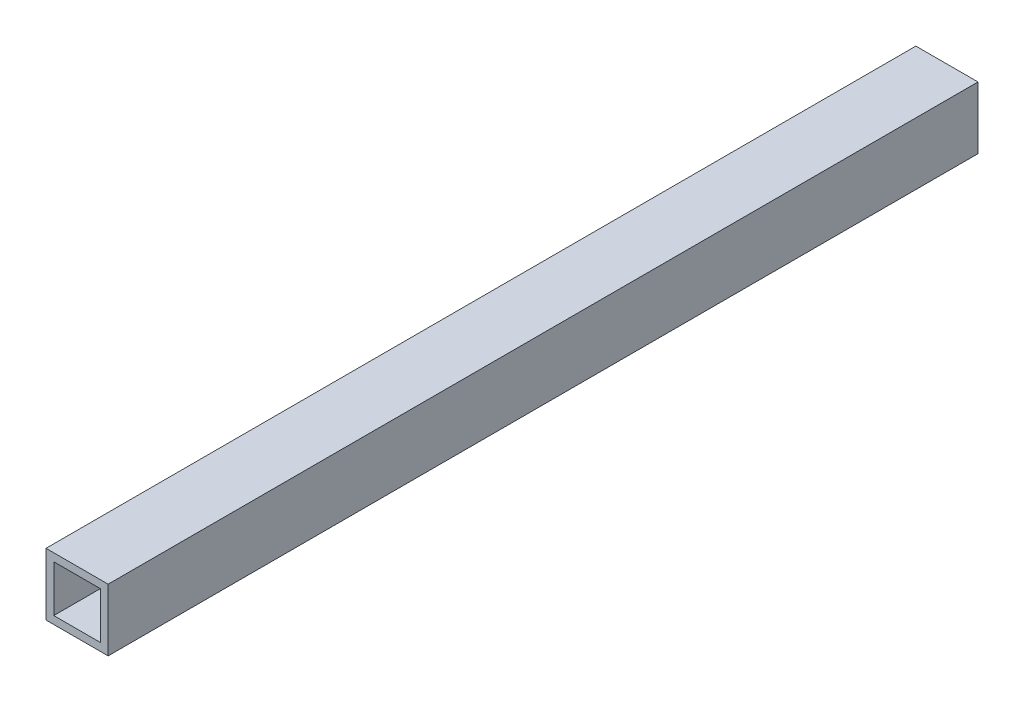
from build123d import *

# Parameters (mm, degrees)
BOSS_EXTRUDE1_DEPTH      = 177.8
BOSS_EXTRUDE1_DEPTH_BACK = 177.8
SKETCH3_W                = 25.4
SKETCH3_H                = 25.4
SKETCH3_W_2              = 19.05
SKETCH3_H_2              = 19.05


with BuildPart() as part:
    # Sketch3 → Boss-Extrude1 (new, two sides: drawn at the far end of the back side and taken through both)
    with BuildSketch(Plane.XY.offset(-BOSS_EXTRUDE1_DEPTH_BACK)):
        Rectangle(SKETCH3_W, SKETCH3_H)
        Rectangle(SKETCH3_W_2, SKETCH3_H_2, mode=Mode.SUBTRACT)
    extrude(amount=BOSS_EXTRUDE1_DEPTH + BOSS_EXTRUDE1_DEPTH_BACK)


solid = part.part
